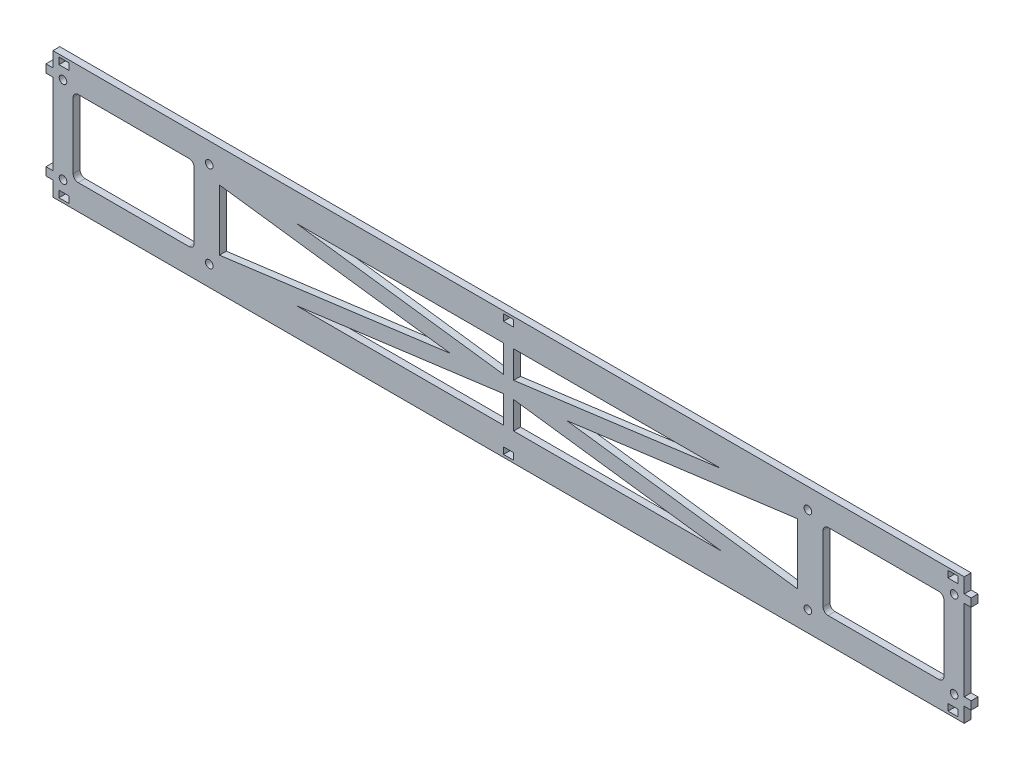
from build123d import *

# Parameters (mm, degrees)
SKETCH1_R           = 0.9525
SKETCH1_W           = 2.54
SKETCH1_H           = 1.651
BOSS_EXTRUDE1_DEPTH = 1.7272
SKETCH3_W           = 1.7272
SKETCH3_H           = 2.032
BOSS_EXTRUDE2_DEPTH = 1.7272


with BuildPart() as part:
    # Sketch1 → Boss-Extrude1 (new body)
    with BuildSketch(Plane.XY):
        Polygon((-114.3, 13.37945), (-114.3, -13.37945), (-114.3, -15.91945), (114.3, -15.91945), (114.3, -13.37945), (114.3, 13.37945), (114.3, 15.91945), (-114.3, 15.91945), align=None)
        with Locations((-111.76, 10.83945)):
            Circle(SKETCH1_R, mode=Mode.SUBTRACT)
        with Locations(Location((-111.76, -10.83945, 0), (0, 0, 180))):
            Circle(SKETCH1_R, mode=Mode.SUBTRACT)
        with Locations((-75.08, 10.83945)):
            Circle(SKETCH1_R, mode=Mode.SUBTRACT)
        with Locations(Location((-75.08, -10.83945, 0), (0, 0, 180))):
            Circle(SKETCH1_R, mode=Mode.SUBTRACT)
        with Locations(Location((75.08, 10.83945, 0), (0, 0, 180))):
            Circle(SKETCH1_R, mode=Mode.SUBTRACT)
        with Locations(Location((111.76, 10.83945, 0), (0, 0, 180))):
            Circle(SKETCH1_R, mode=Mode.SUBTRACT)
        with Locations((111.76, -10.83945)):
            Circle(SKETCH1_R, mode=Mode.SUBTRACT)
        with Locations((75.08, -10.83945)):
            Circle(SKETCH1_R, mode=Mode.SUBTRACT)
        with BuildLine():
            Line((-107.95, -9.56945), (-80.16, -9.56945))
            ThreePointArc((-80.16, -9.56945), (-79.261974388, -9.197475612), (-78.89, -8.29945))
            Line((-78.89, -8.29945), (-78.89, 8.29945))
            ThreePointArc((-78.89, 8.29945), (-79.261974388, 9.197475612), (-80.16, 9.56945))
            Line((-80.16, 9.56945), (-107.95, 9.56945))
            ThreePointArc((-107.95, 9.56945), (-108.848025612, 9.197475612), (-109.22, 8.29945))
            Line((-109.22, 8.29945), (-109.22, -8.29945))
            ThreePointArc((-109.22, -8.29945), (-108.848025612, -9.197475612), (-107.95, -9.56945))
        make_face(mode=Mode.SUBTRACT)
        Polygon((-1.27, -8.93445), (-1.27, -2.088687016), (-53.255686673, -8.93445), align=None, mode=Mode.SUBTRACT)
        with BuildLine():
            Line((78.89, -8.29945), (78.89, 8.29945))
            ThreePointArc((78.89, 8.29945), (79.261974388, 9.197475612), (80.16, 9.56945))
            Line((80.16, 9.56945), (107.95, 9.56945))
            ThreePointArc((107.95, 9.56945), (108.848025612, 9.197475612), (109.22, 8.29945))
            Line((109.22, 8.29945), (109.22, -8.29945))
            ThreePointArc((109.22, -8.29945), (108.848025612, -9.197475612), (107.95, -9.56945))
            Line((107.95, -9.56945), (80.16, -9.56945))
            ThreePointArc((80.16, -9.56945), (79.261974388, -9.197475612), (78.89, -8.29945))
        make_face(mode=Mode.SUBTRACT)
        Polygon((-14.591172672, 0), (-72.54, 7.631022354), (-72.54, -7.631022354), align=None, mode=Mode.SUBTRACT)
        Polygon((-1.27, 8.93445), (-1.27, 2.088687016), (-53.255686673, 8.93445), align=None, mode=Mode.SUBTRACT)
        Polygon((1.27, -8.93445), (1.27, -2.088687016), (53.255686673, -8.93445), align=None, mode=Mode.SUBTRACT)
        Polygon((1.27, 8.93445), (1.27, 2.088687016), (53.255686673, 8.93445), align=None, mode=Mode.SUBTRACT)
        Polygon((14.591172672, 0), (72.54, -7.631022354), (72.54, 7.631022354), align=None, mode=Mode.SUBTRACT)
        with Locations((111.506, 14.45895)):
            Rectangle(SKETCH1_W, SKETCH1_H, mode=Mode.SUBTRACT)
        with Locations((111.506, -14.45895)):
            Rectangle(SKETCH1_W, SKETCH1_H, mode=Mode.SUBTRACT)
        with Locations((-111.506, 14.45895)):
            Rectangle(SKETCH1_W, SKETCH1_H, mode=Mode.SUBTRACT)
        with Locations((-111.506, -14.45895)):
            Rectangle(SKETCH1_W, SKETCH1_H, mode=Mode.SUBTRACT)
        with Locations((0, -14.45895)):
            Rectangle(SKETCH1_W, SKETCH1_H, mode=Mode.SUBTRACT)
        with Locations((0, 14.45895)):
            Rectangle(SKETCH1_W, SKETCH1_H, mode=Mode.SUBTRACT)
    extrude(amount=BOSS_EXTRUDE1_DEPTH)

    # Sketch3 → Boss-Extrude2 (add)
    with BuildSketch(Plane.XY):
        with Locations((-115.1636, 11.176)):
            Rectangle(SKETCH3_W, SKETCH3_H)
        with Locations((-115.1636, -11.176)):
            Rectangle(SKETCH3_W, SKETCH3_H)
        with Locations((115.1636, -11.176)):
            Rectangle(SKETCH3_W, SKETCH3_H)
        with Locations((115.1636, 11.176)):
            Rectangle(SKETCH3_W, SKETCH3_H)
    extrude(amount=BOSS_EXTRUDE2_DEPTH)


solid = part.part
